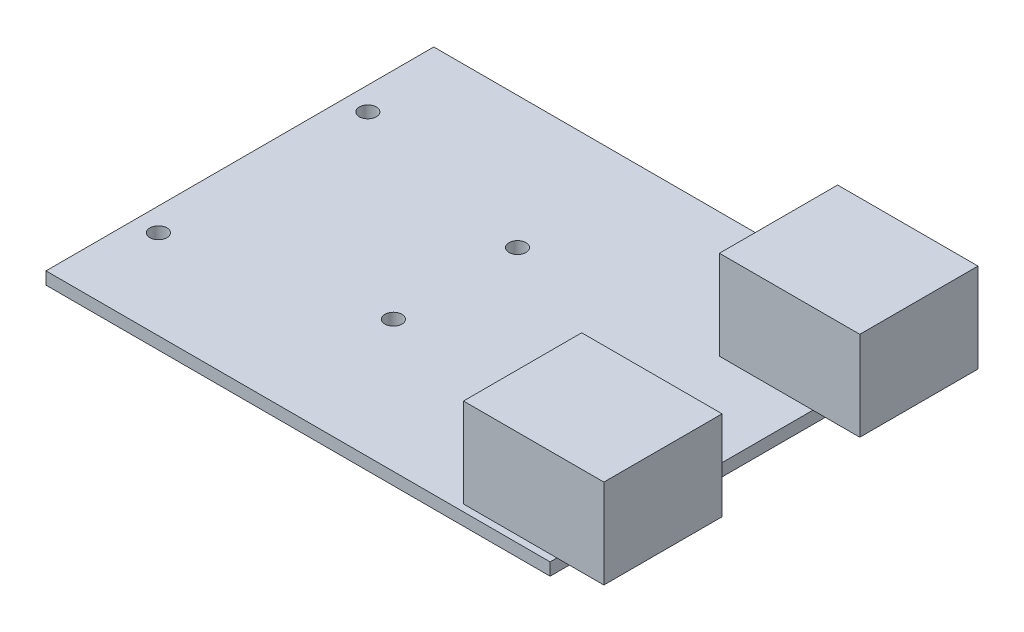
from build123d import *

# Parameters (mm, degrees)
SKETCH1_W             = 65
SKETCH1_H             = 50
BOSS_EXTRUDE1_DEPTH   = 1.6002
F_2_5MM_DOWEL_HOLE1_D = 2.2
SKETCH4_W             = 18.1
SKETCH4_H             = 15.24
BOSS_EXTRUDE2_DEPTH   = 11.5


with BuildPart() as part:
    # Sketch1 → Boss-Extrude1 (new body)
    with BuildSketch(Plane(origin=(0, 0, 0), x_dir=(1, 0, 0), z_dir=(0, 1, 0))):
        with Locations((32.5, 25)):
            Rectangle(SKETCH1_W, SKETCH1_H)
    extrude(amount=BOSS_EXTRUDE1_DEPTH)

    # Ø2.5mm Dowel Hole1 (through all)
    with Locations(Plane(origin=(0, 1.6002, 0), x_dir=(1, 0, 0), z_dir=(0, 1, 0))):
        with Locations((3, 11.5), (3, 38.5), (27.8, 17), (27.8, 33)):
            Hole(F_2_5MM_DOWEL_HOLE1_D / 2)

    # Sketch4 → Boss-Extrude2 (add)
    with BuildSketch(Plane(origin=(0, 1.6002, 0), x_dir=(1, 0, 0), z_dir=(0, 1, 0))):
        with Locations((62, 41.5)):
            Rectangle(SKETCH4_W, SKETCH4_H)
        with Locations((62, 8.5)):
            Rectangle(SKETCH4_W, SKETCH4_H)
    extrude(amount=BOSS_EXTRUDE2_DEPTH)


solid = part.part
